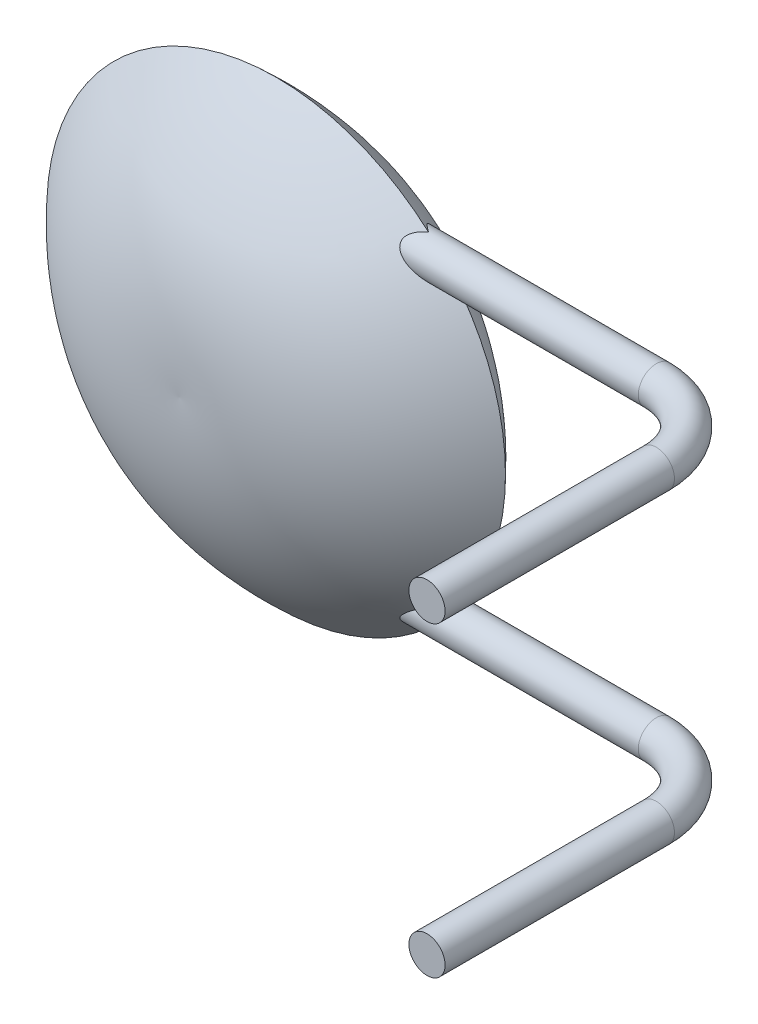
from build123d import *

# Parameters (mm, degrees)
SKETCH4_R = 0.15


with BuildPart() as part:
    # Sketch3 → Revolve1 (revolve)
    with BuildSketch(Plane(origin=(0, 0, 0), x_dir=(1, 0, 0), z_dir=(0, 1, 0))):
        with BuildLine():
            Line((1.9, 0), (0, 0))
            Line((0, 0), (0, -0.8))
            add(Edge.make_bspline(
                [(0, -0.8), (1.106882422, -0.865042619), (1.9, 0)],
                knots=[0, 0, 0, 1, 1, 1], degree=2))
        make_face()
        with BuildLine():
            Line((0, 0.8), (0, 0))
            Line((0, 0), (1.9, 0))
            add(Edge.make_bspline(
                [(0, 0.8), (1.106882422, 0.865042619), (1.9, 0)],
                knots=[0, 0, 0, 1, 1, 1], degree=2))
        make_face()
    revolve(axis=Axis((0, 0, 0.8), (0, 0, -1)))

    # Sweep1: sweep along a path in Sketch5
    with BuildLine(Plane(origin=(0, 1.27, 0), x_dir=(1, 0, 0), z_dir=(0, 1, 0))) as sweep1_path:
        Line((0, 0), (3.15, 0))
        ThreePointArc((3.15, 0), (3.574264069, -0.175735931), (3.75, -0.6))
        Line((3.75, -0.6), (3.75, -2.5))
    # Sketch4 → Sweep1 (sweep)
    with BuildSketch(Plane(origin=(0, 0, 0), x_dir=(0, 0, -1), z_dir=(1, 0, 0))):
        with Locations((0, 1.27)):
            Circle(SKETCH4_R)
    sweep1 = sweep(path=sweep1_path.line)

    # Mirror1: Sweep1 across plane
    add(sweep1.mirror(Plane.ZX))


solid = part.part
